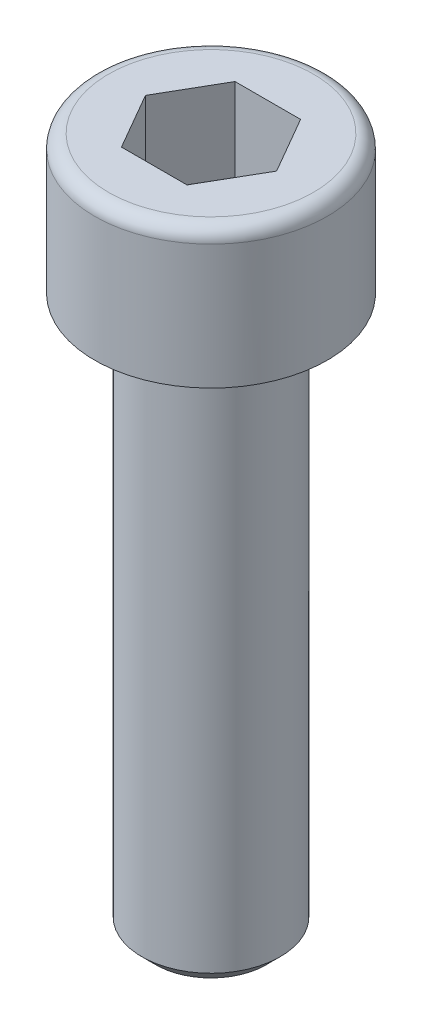
from build123d import *

# Parameters (mm, degrees)
ESQUISSE1_W             = 4.2
ESQUISSE1_H             = 5
ESQUISSE2_R             = 2.5
BOSS_EXTRU_1_DEPTH      = 20
ENL_V_MAT_EXTRU_1_DEPTH = 3
CHANFREIN1_SIZE         = 0.5
CONG_1_R                = 0.5


with BuildPart() as part:
    # Esquisse1 → Révolution1 (revolve)
    with BuildSketch(Plane.XY, mode=Mode.PRIVATE) as r_volution1_sk:
        with Locations((2.1, 2.5)):
            Rectangle(ESQUISSE1_W, ESQUISSE1_H)
    revolve(r_volution1_sk.sketch.rotate(Axis((0, 5, 0), (0, -1, 0)), 270), axis=Axis((0, 5, 0), (0, -1, 0)))

    # Esquisse2 → Boss.-Extru.1 (add)
    with BuildSketch(Plane.XZ):
        with Locations(Location((0, 0, 0), (0, 0, 270))):
            Circle(ESQUISSE2_R)
    extrude(amount=BOSS_EXTRU_1_DEPTH)

    # Esquisse3 → Enlèv. mat.-Extru.1 (cut)
    with BuildSketch(Plane(origin=(0, 5, 0), x_dir=(-1, 0, 0), z_dir=(0, 1, 0))):
        Polygon((1.183568052, 2.05), (-1.183568052, 2.05), (-2.367136104, 0), (-1.183568052, -2.05), (1.183568052, -2.05), (2.367136104, 0), align=None)
    extrude(amount=-ENL_V_MAT_EXTRU_1_DEPTH, mode=Mode.SUBTRACT)

    # Chanfrein1
    chanfrein1_edges = [part.edges().sort_by_distance(p)[0] for p in [
        (0, -20, 2.5),
    ]]
    chamfer(chanfrein1_edges, length=CHANFREIN1_SIZE)

    # Congé1
    cong_1_edges = [part.edges().sort_by_distance(p)[0] for p in [
        (0, 5, 4.2),
    ]]
    fillet(cong_1_edges, radius=CONG_1_R)


solid = part.part
